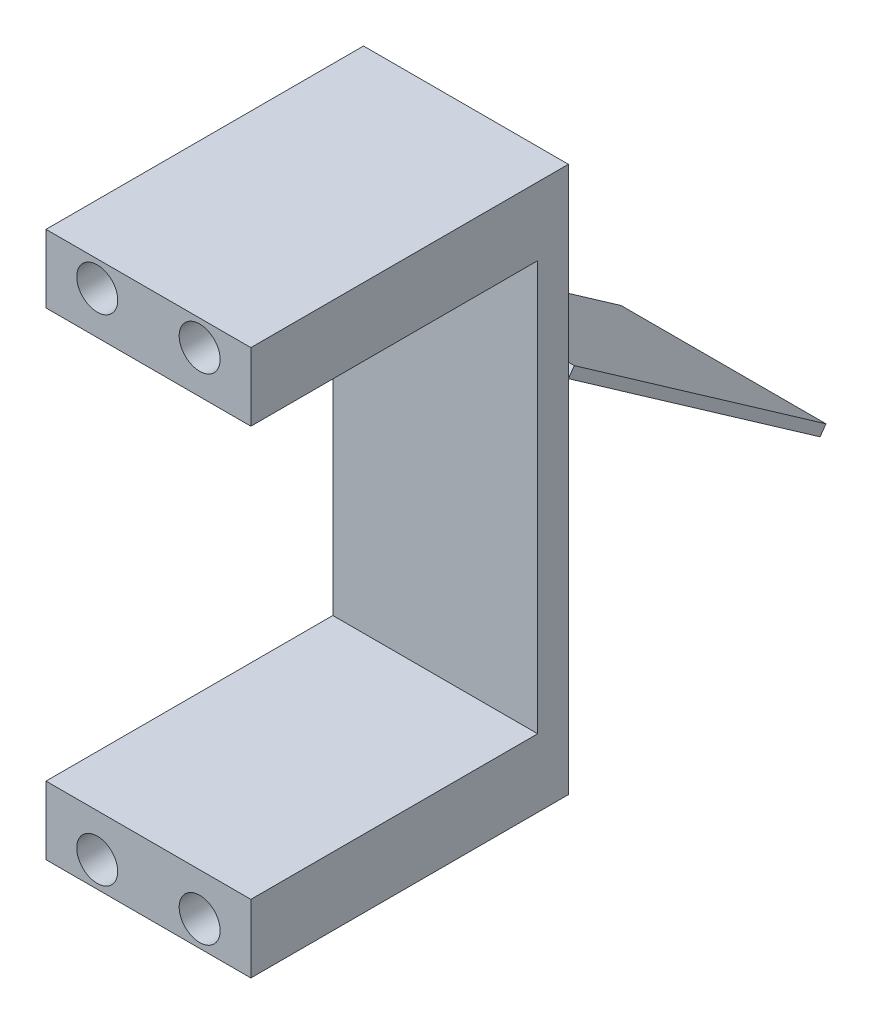
from build123d import *

# Parameters (mm, degrees)
SKETCH3_W           = 20
SKETCH3_H           = 40
BOSS_EXTRUDE1_DEPTH = 3
SKETCH3_3_W         = 20
SKETCH3_3_H         = 6.65
SKETCH3_3_R         = 2
BOSS_EXTRUDE2_DEPTH = 31
SKETCH8_W           = 20
SKETCH8_H           = 30
BOSS_EXTRUDE6_DEPTH = 1


with BuildPart() as part:
    # Sketch3 → Boss-Extrude1 (new body)
    with BuildSketch(Plane.XY):
        with Locations((-7.265593176, 26.478335221)):
            Rectangle(SKETCH3_W, SKETCH3_H)
    extrude(amount=BOSS_EXTRUDE1_DEPTH)

    # Sketch3<3> → Boss-Extrude2 (add)
    # profile 1 of 2: a face of its own
    with BuildSketch(Plane.XY):
        with Locations((-7.265593176, 3.153335221)):
            Rectangle(SKETCH3_3_W, SKETCH3_3_H)
        with Locations((-2.265593176, 2.328335221)):
            Circle(SKETCH3_3_R, mode=Mode.SUBTRACT)
        with Locations((-12.265593176, 2.328335221)):
            Circle(SKETCH3_3_R, mode=Mode.SUBTRACT)
    # profile 2 of 2: a face of its own
    with BuildSketch(Plane.XY):
        with Locations((-7.265593176, 49.803335221)):
            Rectangle(SKETCH3_3_W, SKETCH3_3_H)
        with Locations((-12.265593176, 50.628335221)):
            Circle(SKETCH3_3_R, mode=Mode.SUBTRACT)
        with Locations((-2.265593176, 50.628335221)):
            Circle(SKETCH3_3_R, mode=Mode.SUBTRACT)
    extrude(amount=BOSS_EXTRUDE2_DEPTH)


with BuildPart() as body_2:
    # Sketch8 → Boss-Extrude6 (new body)
    with BuildSketch(Plane(origin=(0, 23.485352508, -16.444620864), x_dir=(1, 0, 0), z_dir=(0, 0.819152044288991, -0.5735764363510473))):
        with Locations((-7.265593176, -5.075175272)):
            Rectangle(SKETCH8_W, SKETCH8_H)
    extrude(amount=BOSS_EXTRUDE6_DEPTH)


solid = Compound([part.part, body_2.part])
